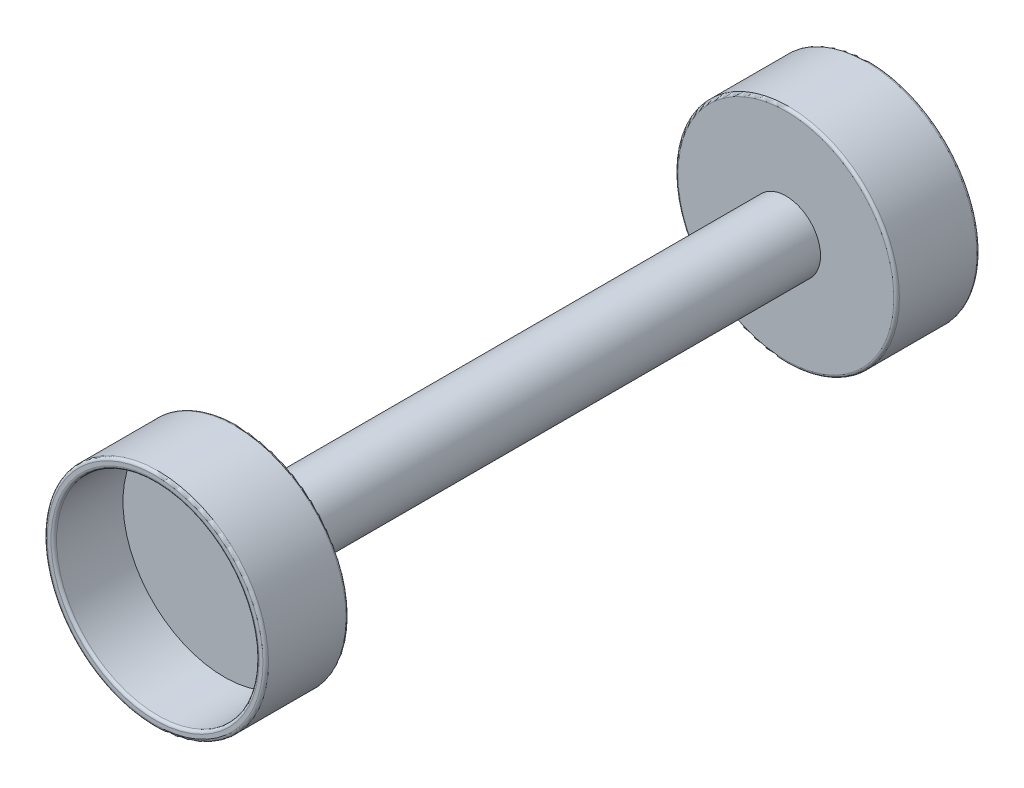
from build123d import *

# Parameters (mm, degrees)
SKETCH4_R            = 31.75
BOSS_EXTRUDE3_DEPTH  = 251.46
SKETCH5_R            = 101.6
BOSS_EXTRUDE4_DEPTH  = 76.2
SKETCH6_R            = 92.964
CUT_EXTRUDE1_DEPTH   = 63.5
FILLET1_R            = 2.54
FILLET2_R            = 2.54
FILLET1_OF_MIRROR1_R = 2.54
FILLET2_OF_MIRROR1_R = 2.54


with BuildPart() as part:
    # Sketch4 → Boss-Extrude3 (new, symmetric)
    with BuildSketch(Plane.XY):
        Circle(SKETCH4_R)
    extrude(amount=BOSS_EXTRUDE3_DEPTH, both=True)

    # Sketch5 → Boss-Extrude4 (add)
    with BuildSketch(Plane.XY.offset(251.46)):
        with Locations(Location((0, 0, 0), (0, 0, 180))):
            Circle(SKETCH5_R)
    boss_extrude4 = extrude(amount=BOSS_EXTRUDE4_DEPTH)

    # Sketch6 → Cut-Extrude1 (cut)
    with BuildSketch(Plane.XY.offset(327.66)):
        Circle(SKETCH6_R)
    cut_extrude1 = extrude(amount=-CUT_EXTRUDE1_DEPTH, mode=Mode.SUBTRACT)

    # Fillet1
    fillet1_edges = [part.edges().sort_by_distance(p)[0] for p in [
        (-92.964, 0, 327.66),
    ]]
    fillet(fillet1_edges, radius=FILLET1_R)

    # Fillet2
    fillet2_edges = [part.edges().sort_by_distance(p)[0] for p in [
        (101.6, 0, 251.46),
        (101.6, 0, 327.66),
    ]]
    fillet(fillet2_edges, radius=FILLET2_R)

    # Mirror1: Boss-Extrude4, Cut-Extrude1 across plane
    add(boss_extrude4.mirror(Plane.XY))
    add(cut_extrude1.mirror(Plane.XY), mode=Mode.SUBTRACT)

    # Fillet1 of Mirror1
    fillet1_of_mirror1_edges = [part.edges().sort_by_distance(p)[0] for p in [
        (-92.964, 0, -327.66),
    ]]
    fillet(fillet1_of_mirror1_edges, radius=FILLET1_OF_MIRROR1_R)

    # Fillet2 of Mirror1
    fillet2_of_mirror1_edges = [part.edges().sort_by_distance(p)[0] for p in [
        (101.6, 0, -251.46),
        (101.6, 0, -327.66),
    ]]
    fillet(fillet2_of_mirror1_edges, radius=FILLET2_OF_MIRROR1_R)


solid = part.part
